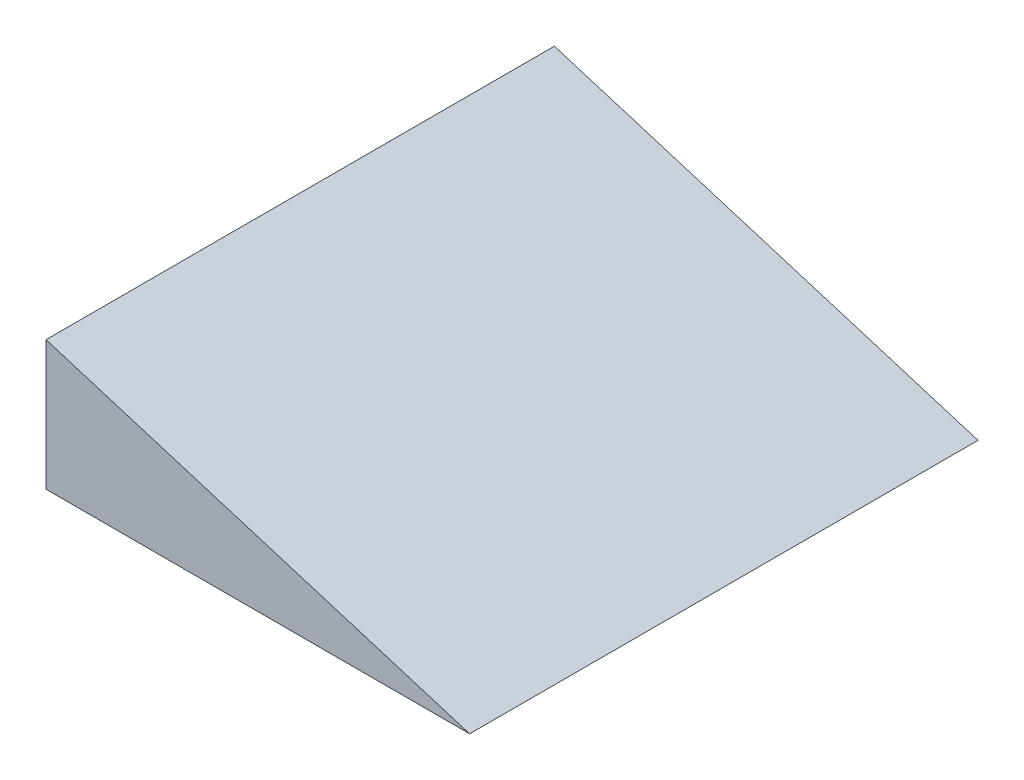
from build123d import *

# Parameters (mm, degrees)
EXTRUDE_1_DEPTH = 600


with BuildPart() as part:
    # 草图1 → 凸台-拉伸1 (new body)
    with BuildSketch(Plane.XY):
        Polygon((0, 0), (-500, 0), (-500, 152.865340729), align=None)
    extrude(amount=-EXTRUDE_1_DEPTH)


solid = part.part
